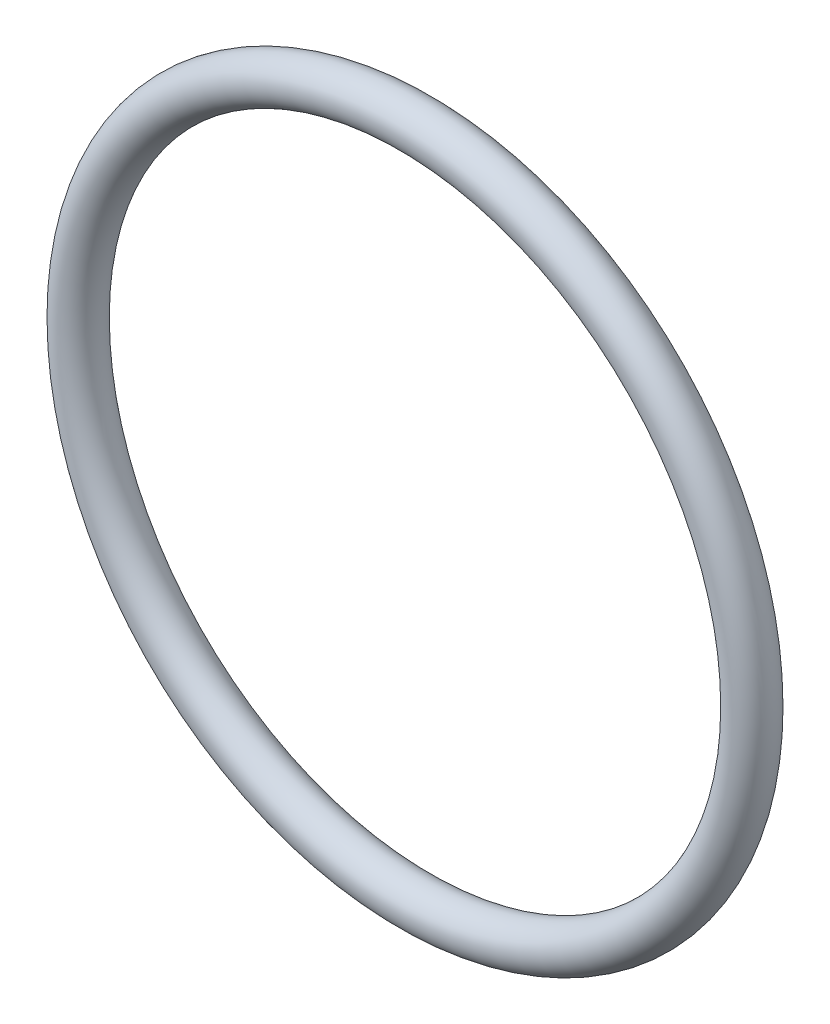
from build123d import *

# Parameters (mm, degrees)
SWEEP_1_PROFILE_R = 7


with BuildPart() as part:
    # ｽｲｰﾌﾟ1: sweep along a path in ｽｹｯﾁ1
    with BuildLine(Plane.XY) as sweep_1_path:
        CenterArc((0, 0), 107, 0, 360)
    # ｽｲｰﾌﾟ1 profile (on start of the path) → ｽｲｰﾌﾟ1 (sweep)
    with BuildSketch(Plane(origin=(107, 0, 0), x_dir=(0, 0, 1), z_dir=(0, 1, 0))):
        Circle(SWEEP_1_PROFILE_R)
    sweep(path=sweep_1_path.line)


solid = part.part
